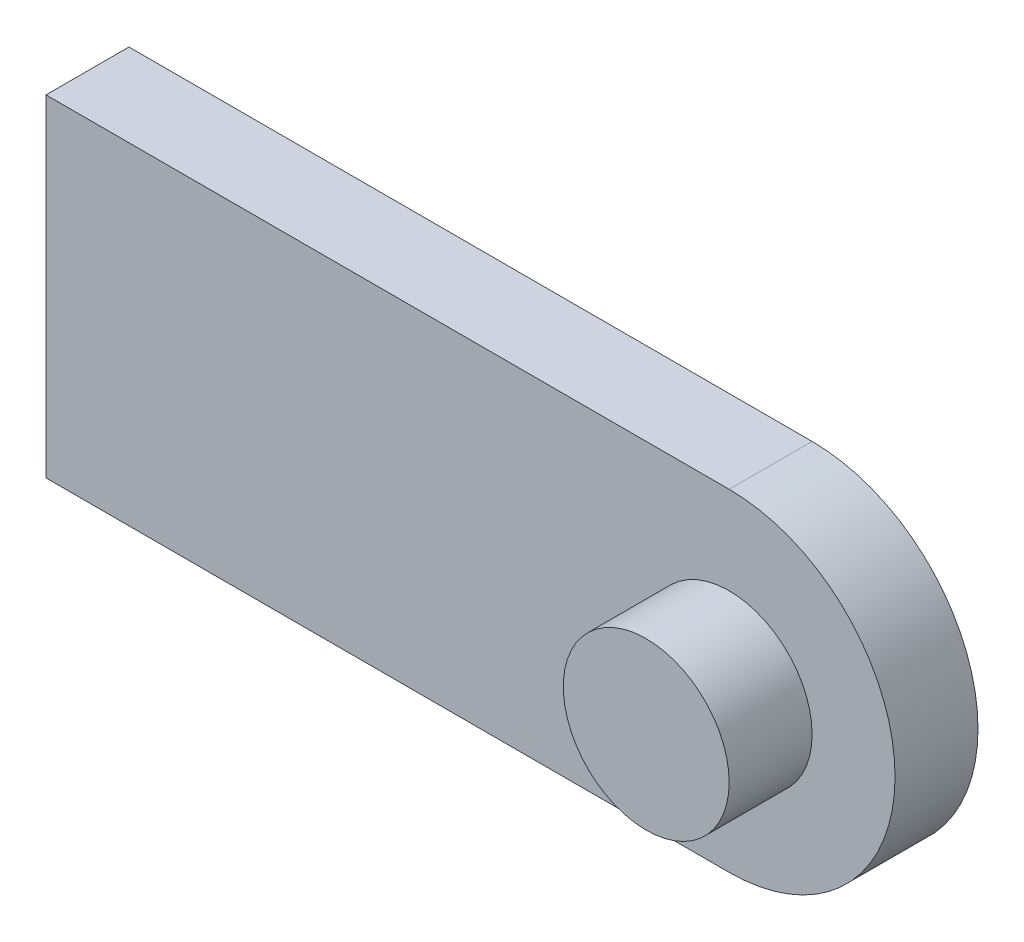
from build123d import *

# Parameters (mm, degrees)
EXTRUDE_1_DEPTH = 10
SKETCH_2_R      = 10
EXTRUDE_2_DEPTH = 10


with BuildPart() as part:
    # 스케치1 → 보스-돌출1 (new body)
    with BuildSketch(Plane.XY):
        with BuildLine():
            Line((0, 20), (-82.363877474, 20))
            Line((-82.363877474, 20), (-82.363877474, -20))
            Line((-82.363877474, -20), (0, -20))
            ThreePointArc((0, -20), (20, 0), (0, 20))
        make_face()
    extrude(amount=EXTRUDE_1_DEPTH)

    # 스케치2 → 보스-돌출2 (add)
    with BuildSketch(Plane.XY.offset(10)):
        with Locations((0, -0.593223752)):
            Circle(SKETCH_2_R)
    extrude(amount=EXTRUDE_2_DEPTH)


solid = part.part
